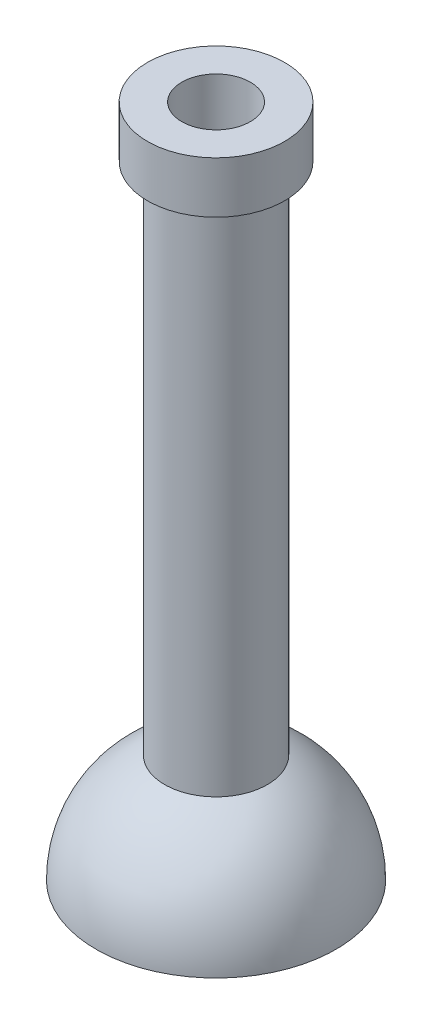
from build123d import *

# Parameters (mm, degrees)
SKETCH2_R          = 2
CUT_EXTRUDE1_DEPTH = 41.551456831


with BuildPart() as part:
    # Sketch1 → Revolve1 (revolve)
    with BuildSketch(Plane.XY, mode=Mode.PRIVATE) as revolve1_sk:
        with BuildLine():
            ThreePointArc((5, -39.32455532), (3.535533906, -35.789021414), (0, -34.32455532))
            Line((0, -34.32455532), (0, -30))
            Line((0, -30), (0, 0))
            Line((0, 0), (4, 0))
            Line((4, 0), (4, -3))
            Line((4, -3), (3, -3))
            Line((3, -3), (3, -33))
            ThreePointArc((3, -33), (5.916079783, -35.582897934), (7, -39.32455532))
            Line((7, -39.32455532), (5, -39.32455532))
        make_face()
    revolve(revolve1_sk.sketch.rotate(Axis((0, 0, 0), (0, -1, 0)), 180), axis=Axis((0, 0, 0), (0, -1, 0)))

    # Sketch2 → Cut-Extrude1 (cut, through all)
    with BuildSketch(Plane(origin=(0, 0, 0), x_dir=(1, 0, 0), z_dir=(0, 1, 0))):
        with Locations(Location((0, 0, 0), (0, 0, 180))):
            Circle(SKETCH2_R)
    extrude(amount=-CUT_EXTRUDE1_DEPTH, mode=Mode.SUBTRACT)


solid = part.part
